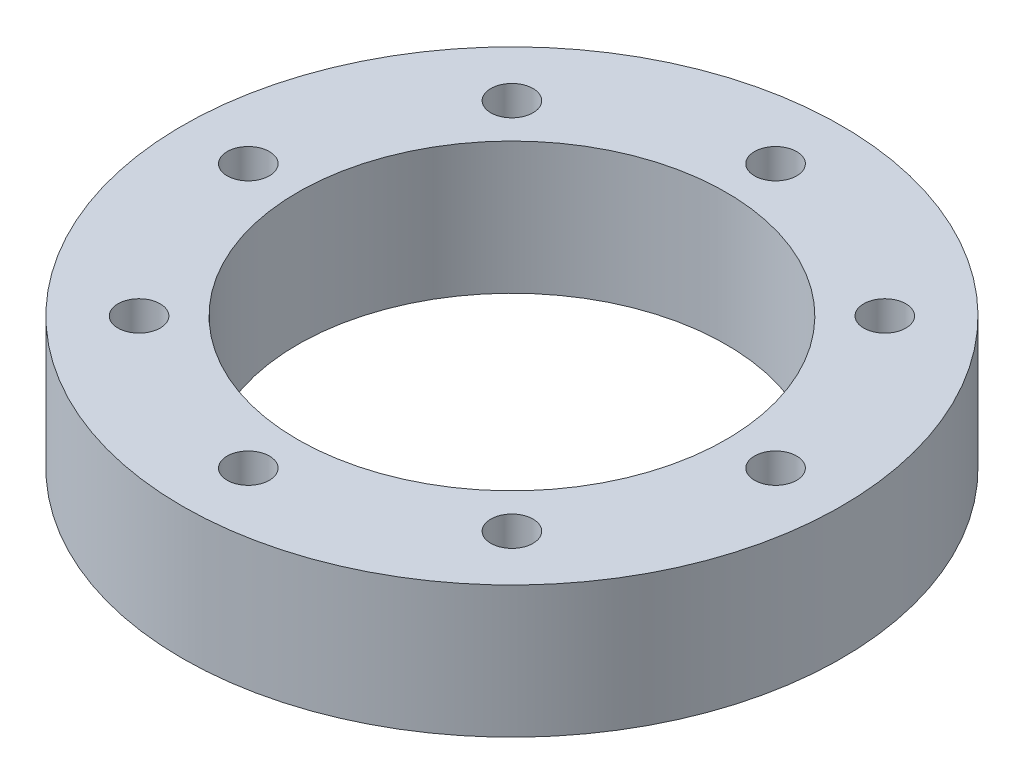
from build123d import *

# Parameters (mm, degrees)
SKETCH_1_R          = 50
SKETCH_1_R_2        = 32.5
EXTRUDE_1_DEPTH     = 20
SKETCH_2_R          = 3.2
CUT_EXTRUDE_1_DEPTH = 20


with BuildPart() as part:
    # 草图1 → 凸台-拉伸1 (new body)
    with BuildSketch(Plane(origin=(0, 0, 0), x_dir=(1, 0, 0), z_dir=(0, 1, 0))):
        with Locations(Location((0, 0, 0), (0, 0, 270))):
            Circle(SKETCH_1_R)
        with Locations(Location((0, 0, 0), (0, 0, 270))):
            Circle(SKETCH_1_R_2, mode=Mode.SUBTRACT)
    extrude(amount=EXTRUDE_1_DEPTH)

    # 草图2 → 切除-拉伸1 (cut)
    with BuildSketch(Plane(origin=(0, 20, 0), x_dir=(1, 0, 0), z_dir=(0, 1, 0))):
        with Locations(Location((0, 40, 0), (0, 0, 270))):
            Circle(SKETCH_2_R)
        with Locations(Location((28.284271247, 28.284271247, 0), (0, 0, 270))):
            Circle(SKETCH_2_R)
        with Locations(Location((40, 0, 0), (0, 0, 270))):
            Circle(SKETCH_2_R)
        with Locations(Location((28.284271247, -28.284271247, 0), (0, 0, 270))):
            Circle(SKETCH_2_R)
        with Locations(Location((0, -40, 0), (0, 0, 270))):
            Circle(SKETCH_2_R)
        with Locations(Location((-28.284271247, -28.284271247, 0), (0, 0, 270))):
            Circle(SKETCH_2_R)
        with Locations(Location((-40, 0, 0), (0, 0, 270))):
            Circle(SKETCH_2_R)
        with Locations(Location((-28.284271247, 28.284271247, 0), (0, 0, 270))):
            Circle(SKETCH_2_R)
    extrude(amount=-CUT_EXTRUDE_1_DEPTH, mode=Mode.SUBTRACT)


solid = part.part
